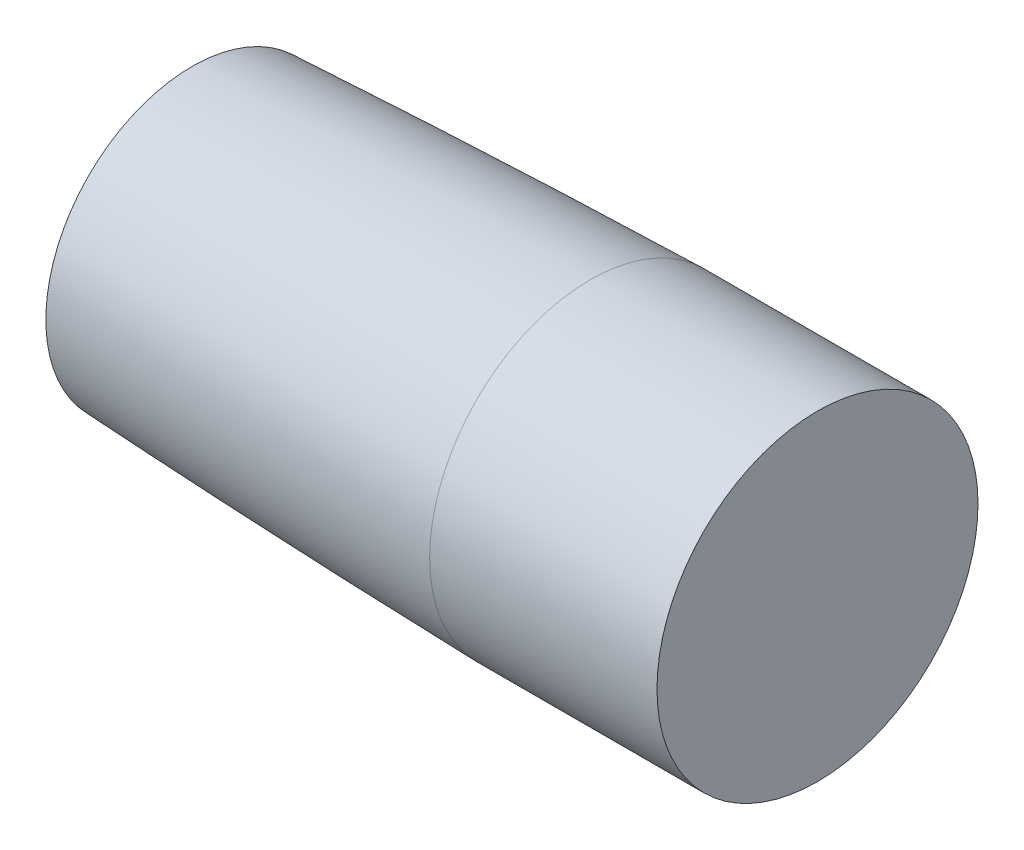
from build123d import *

# Parameters (mm, degrees)
SKETCH2_R          = 12.7
CUT_EXTRUDE1_DEPTH = 50.8


with BuildPart() as part:
    # Sketch1 → Revolve1 (revolve)
    with BuildSketch(Plane(origin=(0, 0, 0), x_dir=(1, 0, 0), z_dir=(0, 1, 0))):
        with BuildLine():
            Line((490.970000001, 47.8009847), (558.67, 47.8009847))
            Line((558.67, 47.8009847), (558.67, 0))
            Line((558.67, 0), (372.400000001, 0))
            Line((372.400000001, 0), (372.400000001, 43.54127618))
            add(Edge.make_bspline(
                [(372.400000001, 43.54127618), (373.249304538, 43.582834208), (374.969174697, 43.666367025), (378.947630502, 43.85823985), (382.338814459, 44.016709221), (386.793767836, 44.223555396), (390.662889883, 44.397994639), (395.609607152, 44.618105901), (401.394253179, 44.867843931), (408.312611991, 45.157846051), (416.185500171, 45.473351627), (424.336527511, 45.786561408), (432.505238251, 46.085011131), (440.616250239, 46.36827021), (448.841670657, 46.639557014), (456.867468273, 46.892110486), (465.238945097, 47.138162557), (472.357231345, 47.337858443), (479.39947414, 47.52063336), (484.034315216, 47.637705054), (488.446782872, 47.742316661), (490.119904256, 47.781427676), (490.970000001, 47.8009847)],
                knots=[0.082616471, 0.082616471, 0.082616471, 0.082616471, 0.082616471, 0.111283047, 0.139949623, 0.168616199, 0.197282775, 0.225949351, 0.254615927, 0.304729739, 0.362062891, 0.419396043, 0.476729195, 0.534062348, 0.5913955, 0.648728652, 0.706061804, 0.763394956, 0.820728108, 0.859301516, 0.887968092, 0.916634668, 0.916634668, 0.916634668, 0.916634668, 0.916634668], degree=4))
        make_face()
    revolve(axis=Axis((558.67, 0, 0), (-1, 0, 0)))

    # Sketch2 → Cut-Extrude1 (cut)
    with BuildSketch(Plane.ZY.offset(-372.400000001)):
        Circle(SKETCH2_R)
    extrude(amount=-CUT_EXTRUDE1_DEPTH, mode=Mode.SUBTRACT)


solid = part.part
